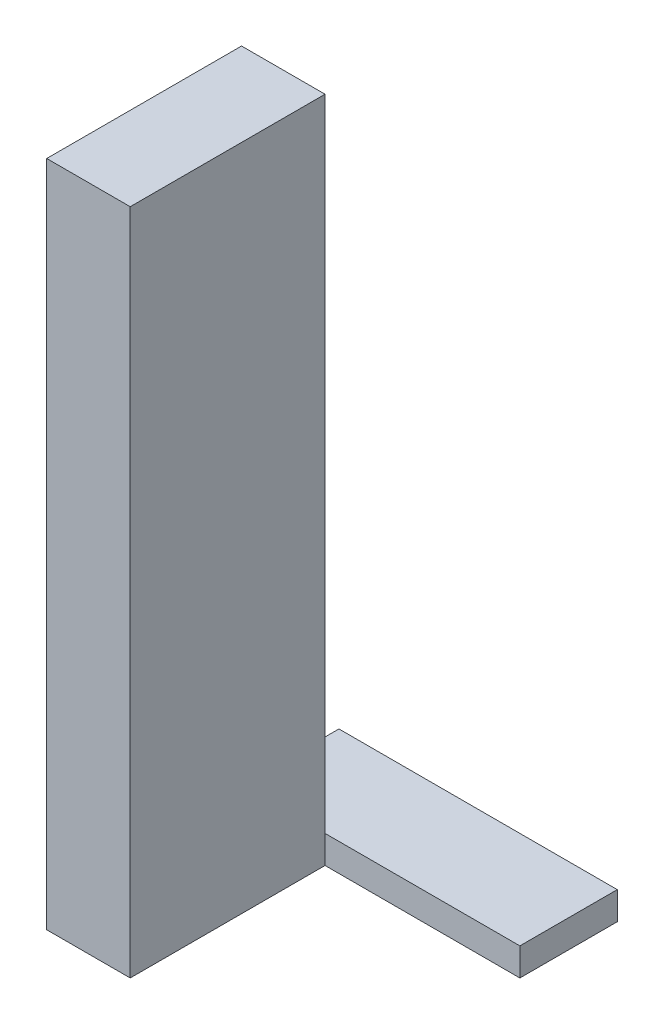
from build123d import *

# Parameters (mm, degrees)
SKETCH1_W     = 28
SKETCH1_H     = 96
UPRIGHT_DEPTH = 12
SKETCH2_W     = 14
SKETCH2_H     = 4
FOOT_DEPTH    = 40


with BuildPart() as part:
    # Sketch1 → upright (new body)
    with BuildSketch(Plane(origin=(0, 0, 0), x_dir=(0, 0, -1), z_dir=(1, 0, 0))):
        with Locations((-498, 438)):
            Rectangle(SKETCH1_W, SKETCH1_H)
    extrude(amount=UPRIGHT_DEPTH)


with BuildPart() as body_2:
    # Sketch2 → foot (new body)
    with BuildSketch(Plane(origin=(0, 0, 0), x_dir=(0, 0, -1), z_dir=(1, 0, 0))):
        with Locations((-477, 392)):
            Rectangle(SKETCH2_W, SKETCH2_H)
    extrude(amount=FOOT_DEPTH)


solid = Compound([part.part, body_2.part])
